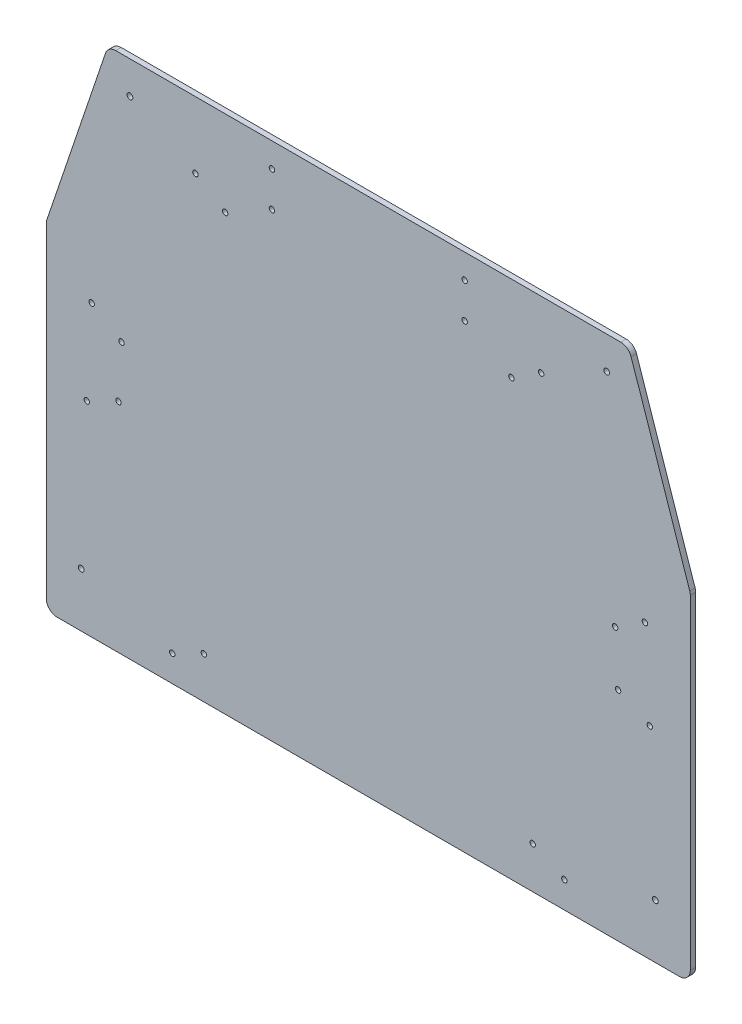
from build123d import *

# Parameters (mm, degrees)
SKETCH1_R                             = 5.3578125
BOSS_EXTRUDE1_DEPTH                   = 6.35
FILLET1_R                             = 6.35
CUT_EXTRUDE1_DEPTH                    = 1167.284548985
BOSS_EXTRUDE3_DEPTH                   = 6.35
SKETCH13_W                            = 3.175
SKETCH13_H                            = 76.2
F_1_4_0_25_DIAMETER_HOLE4_AT_2_COUNT  = 2
F_1_4_0_25_DIAMETER_HOLE4_AT_2_PITCH  = 459.678567638
F_1_4_0_25_DIAMETER_HOLE4_AT_3_COUNT  = 2
F_1_4_0_25_DIAMETER_HOLE4_AT_3_PITCH  = 596.539198556
F_1_4_0_25_DIAMETER_HOLE4_AT_4_COUNT  = 2
F_1_4_0_25_DIAMETER_HOLE4_AT_4_PITCH  = 568.707381741
F_1_4_0_25_DIAMETER_HOLE4_AT_5_COUNT  = 2
F_1_4_0_25_DIAMETER_HOLE4_AT_5_PITCH  = 422.93434027
F_1_4_0_25_DIAMETER_HOLE4_AT_6_COUNT  = 2
F_1_4_0_25_DIAMETER_HOLE4_AT_6_PITCH  = 592.904725038
F_1_4_0_25_DIAMETER_HOLE4_AT_7_COUNT  = 2
F_1_4_0_25_DIAMETER_HOLE4_AT_7_PITCH  = 634.11103449
F_1_4_0_25_DIAMETER_HOLE4_AT_8_COUNT  = 2
F_1_4_0_25_DIAMETER_HOLE4_AT_8_PITCH  = 622.278043561
F_1_4_0_25_DIAMETER_HOLE4_AT_9_COUNT  = 2
F_1_4_0_25_DIAMETER_HOLE4_AT_9_PITCH  = 661.65758107
F_1_4_0_25_DIAMETER_HOLE4_AT_10_COUNT = 2
F_1_4_0_25_DIAMETER_HOLE4_AT_10_PITCH = 648.217378276
F_1_4_0_25_DIAMETER_HOLE4_AT_11_COUNT = 2
F_1_4_0_25_DIAMETER_HOLE4_AT_11_PITCH = 613.575602616
F_1_4_0_25_DIAMETER_HOLE4_AT_12_COUNT = 2
F_1_4_0_25_DIAMETER_HOLE4_AT_12_PITCH = 522.113747952
F_1_4_0_25_DIAMETER_HOLE4_AT_13_COUNT = 2
F_1_4_0_25_DIAMETER_HOLE4_AT_13_PITCH = 562.417563003
F_1_4_0_25_DIAMETER_HOLE4_AT_14_COUNT = 2
F_1_4_0_25_DIAMETER_HOLE4_AT_14_PITCH = 501.478009771
F_1_4_0_25_DIAMETER_HOLE4_AT_15_COUNT = 2
F_1_4_0_25_DIAMETER_HOLE4_AT_15_PITCH = 482.69646419
F_1_4_0_25_DIAMETER_HOLE4_AT_16_COUNT = 2
F_1_4_0_25_DIAMETER_HOLE4_AT_16_PITCH = 322.499599747
F_1_4_0_25_DIAMETER_HOLE4_AT_17_COUNT = 2
F_1_4_0_25_DIAMETER_HOLE4_AT_17_PITCH = 292.440889916
F_1_4_0_25_DIAMETER_HOLE4_AT_18_COUNT = 2
F_1_4_0_25_DIAMETER_HOLE4_AT_18_PITCH = 41.275
F_1_4_0_25_DIAMETER_HOLE4_AT_19_COUNT = 2
F_1_4_0_25_DIAMETER_HOLE4_AT_19_PITCH = 232.85825455
F_1_4_0_25_DIAMETER_HOLE4_AT_20_COUNT = 2
F_1_4_0_25_DIAMETER_HOLE4_AT_20_PITCH = 229.170986574
SKETCH15_W                            = 754.968667661
SKETCH15_H                            = 28.575
CUT_EXTRUDE3_DEPTH                    = 1079.081505166
F_17_64_0_26563_DIAMETER_HOLE1_D      = 6.747002
CUT_EXTRUDE4_DEPTH                    = 1056.085396105
FILLET2_R                             = 12.7


with BuildPart() as part:
    # Sketch1 → Boss-Extrude1 (new body)
    with BuildSketch(Plane.XY):
        Polygon((128.546632935, 292.971606529), (382.546632935, 292.971606529), (776.246632935, -872.634633965), (-265.153367065, -872.634633965), align=None)
        with Locations((396.756156044, 191.371606529)):
            Circle(SKETCH1_R, mode=Mode.SUBTRACT)
        with Locations((114.659199441, 192.325199783)):
            Circle(SKETCH1_R, mode=Mode.SUBTRACT)
        with Locations((-193.570796303, -720.234633965)):
            Circle(SKETCH1_R, mode=Mode.SUBTRACT)
        with Locations((704.664062174, -720.234633965)):
            Circle(SKETCH1_R, mode=Mode.SUBTRACT)
        with Locations((491.127459301, -88.028393471)):
            Circle(SKETCH1_R, mode=Mode.SUBTRACT)
        with Locations((593.220051006, -390.288393471)):
            Circle(SKETCH1_R, mode=Mode.SUBTRACT)
        with Locations((19.96580657, -88.028393471)):
            Circle(SKETCH1_R, mode=Mode.SUBTRACT)
        with Locations((-82.126785136, -390.288393471)):
            Circle(SKETCH1_R, mode=Mode.SUBTRACT)
        with Locations((306.346632935, 271.727158802)):
            Circle(SKETCH1_R, mode=Mode.SUBTRACT)
        with Locations((204.746632935, 271.727158802)):
            Circle(SKETCH1_R, mode=Mode.SUBTRACT)
        with Locations((-82.126785136, -834.534633965)):
            Circle(SKETCH1_R, mode=Mode.SUBTRACT)
        with Locations((593.220051006, -834.534633965)):
            Circle(SKETCH1_R, mode=Mode.SUBTRACT)
        with BuildLine():
            Line((-180.239726648, -736.327985402), (-172.111642745, -712.26360816))
            ThreePointArc((-172.111642745, -712.26360816), (-156.015412172, -704.29546149), (-148.047265502, -720.391692063))
            Line((-148.047265502, -720.391692063), (-156.175349405, -744.456069305))
            ThreePointArc((-156.175349405, -744.456069305), (-172.271579978, -752.424215975), (-180.239726648, -736.327985402))
        make_face(mode=Mode.SUBTRACT)
        with BuildLine():
            Line((-94.231734473, -791.354633965), (-68.831734473, -791.354633965))
            ThreePointArc((-68.831734473, -791.354633965), (-56.131734473, -804.054633965), (-68.831734473, -816.754633965))
            Line((-68.831734473, -816.754633965), (-94.231734473, -816.754633965))
            ThreePointArc((-94.231734473, -816.754633965), (-106.931734473, -804.054633965), (-94.231734473, -791.354633965))
        make_face(mode=Mode.SUBTRACT)
        with BuildLine():
            Line((580.520051006, -791.354633965), (605.920051006, -791.354633965))
            ThreePointArc((605.920051006, -791.354633965), (618.620051006, -804.054633965), (605.920051006, -816.754633965))
            Line((605.920051006, -816.754633965), (580.520051006, -816.754633965))
            ThreePointArc((580.520051006, -816.754633965), (567.820051006, -804.054633965), (580.520051006, -791.354633965))
        make_face(mode=Mode.SUBTRACT)
        with BuildLine():
            Line((-68.772097635, -406.311820835), (-60.644013732, -382.247443592))
            ThreePointArc((-60.644013732, -382.247443592), (-44.54778316, -374.279296923), (-36.57963649, -390.375527495))
            Line((-36.57963649, -390.375527495), (-44.707720392, -414.439904738))
            ThreePointArc((-44.707720392, -414.439904738), (-60.803950965, -422.408051408), (-68.772097635, -406.311820835))
        make_face(mode=Mode.SUBTRACT)
        with BuildLine():
            Line((33.202373314, -104.401534553), (41.330457217, -80.33715731))
            ThreePointArc((41.330457217, -80.33715731), (57.426687789, -72.36901064), (65.394834459, -88.465241213))
            Line((65.394834459, -88.465241213), (57.266750557, -112.529618456))
            ThreePointArc((57.266750557, -112.529618456), (41.170519984, -120.497765125), (33.202373314, -104.401534553))
        make_face(mode=Mode.SUBTRACT)
        with BuildLine():
            Line((127.949253412, 176.110415433), (136.077337315, 200.174792676))
            ThreePointArc((136.077337315, 200.174792676), (152.173567887, 208.142939345), (160.141714557, 192.046708773))
            Line((160.141714557, 192.046708773), (152.013630654, 167.98233153))
            ThreePointArc((152.013630654, 167.98233153), (135.917400082, 160.01418486), (127.949253412, 176.110415433))
        make_face(mode=Mode.SUBTRACT)
        with BuildLine():
            Line((192.113515822, 253.947158802), (217.513515822, 253.947158802))
            ThreePointArc((217.513515822, 253.947158802), (230.213515822, 241.247158802), (217.513515822, 228.547158802))
            Line((217.513515822, 228.547158802), (192.113515822, 228.547158802))
            ThreePointArc((192.113515822, 228.547158802), (179.413515822, 241.247158802), (192.113515822, 253.947158802))
        make_face(mode=Mode.SUBTRACT)
        with BuildLine():
            Line((293.646632935, 253.947158802), (319.046632935, 253.947158802))
            ThreePointArc((319.046632935, 253.947158802), (331.746632935, 241.247158802), (319.046632935, 228.547158802))
            Line((319.046632935, 228.547158802), (293.646632935, 228.547158802))
            ThreePointArc((293.646632935, 228.547158802), (280.946632935, 241.247158802), (293.646632935, 253.947158802))
        make_face(mode=Mode.SUBTRACT)
        with BuildLine():
            Line((359.065010443, 168.025630302), (350.936926541, 192.090007545))
            ThreePointArc((350.936926541, 192.090007545), (358.905073211, 208.186238118), (375.001303783, 200.218091448))
            Line((375.001303783, 200.218091448), (383.129387686, 176.153714205))
            ThreePointArc((383.129387686, 176.153714205), (375.161241016, 160.057483633), (359.065010443, 168.025630302))
        make_face(mode=Mode.SUBTRACT)
        with BuildLine():
            Line((453.826515314, -112.529618456), (445.698431411, -88.465241213))
            ThreePointArc((445.698431411, -88.465241213), (453.666578081, -72.36901064), (469.762808654, -80.33715731))
            Line((469.762808654, -80.33715731), (477.890892557, -104.401534553))
            ThreePointArc((477.890892557, -104.401534553), (469.922745887, -120.497765125), (453.826515314, -112.529618456))
        make_face(mode=Mode.SUBTRACT)
        with BuildLine():
            Line((555.800986263, -414.439904738), (547.67290236, -390.375527495))
            ThreePointArc((547.67290236, -390.375527495), (555.64104903, -374.279296923), (571.737279603, -382.247443592))
            Line((571.737279603, -382.247443592), (579.865363506, -406.311820835))
            ThreePointArc((579.865363506, -406.311820835), (571.897216836, -422.408051408), (555.800986263, -414.439904738))
        make_face(mode=Mode.SUBTRACT)
        with BuildLine():
            Line((667.268615276, -744.456069305), (659.140531373, -720.391692063))
            ThreePointArc((659.140531373, -720.391692063), (667.108678043, -704.29546149), (683.204908616, -712.26360816))
            Line((683.204908616, -712.26360816), (691.332992518, -736.327985402))
            ThreePointArc((691.332992518, -736.327985402), (683.364845848, -752.424215975), (667.268615276, -744.456069305))
        make_face(mode=Mode.SUBTRACT)
    extrude(amount=BOSS_EXTRUDE1_DEPTH)

    # Fillet1
    fillet1_edges = [part.edges().sort_by_distance(p)[0] for p in [
        (128.546632935, 292.971606529, 3.175),
        (382.546632935, 292.971606529, 3.175),
        (776.246632935, -872.634633965, 3.175),
        (-265.153367065, -872.634633965, 3.175),
    ]]
    fillet(fillet1_edges, radius=FILLET1_R)

    # Sketch2 → Cut-Extrude1 (cut, through all)
    with BuildSketch(Plane.XY.offset(6.35)):
        with BuildLine():
            Line((91.647166248, -808.257330621), (67.972798838, -842.067831249))
            ThreePointArc((67.972798838, -842.067831249), (255.546632935, -247.159633965), (443.120467033, -842.067831249))
            Line((443.120467033, -842.067831249), (419.446099623, -808.257330621))
            ThreePointArc((419.446099623, -808.257330621), (255.546632935, -288.434633965), (91.647166248, -808.257330621))
        make_face()
    extrude(amount=-CUT_EXTRUDE1_DEPTH, mode=Mode.SUBTRACT)


with BuildPart() as body_2:
    # Sketch7 → Boss-Extrude3 (new body)
    with BuildSketch(Plane(origin=(0, 0, -63.5), x_dir=(-1, 0, 0), z_dir=(0, 0, -1))):
        Polygon((121.937700895, -872.634633965), (-633.030966766, -872.634633965), (-633.030966766, -448.623777416), (-547.825183006, -196.359633965), (36.731917136, -196.359633965), (121.937700895, -448.623777416), align=None)
    extrude(amount=BOSS_EXTRUDE3_DEPTH)

    # Sketch13 → 1/4 (0.25) Diameter Hole4 (revolve, cut)
    with BuildSketch(Plane(origin=(25.707349116, -813.178486157, -69.85), x_dir=(0, 1, 0), z_dir=(1, 0, 0))):
        with Locations((1.5875, 38.1)):
            Rectangle(SKETCH13_W, SKETCH13_H)
    f_1_4_0_25_diameter_hole4 = revolve(axis=Axis((25.707349116, -813.178486157, -76.2), (0, 0, 1)), mode=Mode.SUBTRACT)

    # 1/4 (0.25) Diameter Hole4 at 2: 1/4 (0.25) Diameter Hole4 ×2
    with Locations(*[(i * F_1_4_0_25_DIAMETER_HOLE4_AT_2_PITCH, 0, 0) for i in range(1, F_1_4_0_25_DIAMETER_HOLE4_AT_2_COUNT)]):
        add(f_1_4_0_25_diameter_hole4, mode=Mode.SUBTRACT)

    # 1/4 (0.25) Diameter Hole4 at 3: 1/4 (0.25) Diameter Hole4 ×2
    with Locations(*[Vector(0.9383907690341254, 0.345575989605098, 0) * (i * F_1_4_0_25_DIAMETER_HOLE4_AT_3_PITCH) for i in range(1, F_1_4_0_25_DIAMETER_HOLE4_AT_3_COUNT)]):
        add(f_1_4_0_25_diameter_hole4, mode=Mode.SUBTRACT)

    # 1/4 (0.25) Diameter Hole4 at 4: 1/4 (0.25) Diameter Hole4 ×2
    with Locations(*[Vector(0.9190282606116896, 0.39419164907066767, 0) * (i * F_1_4_0_25_DIAMETER_HOLE4_AT_4_PITCH) for i in range(1, F_1_4_0_25_DIAMETER_HOLE4_AT_4_COUNT)]):
        add(f_1_4_0_25_diameter_hole4, mode=Mode.SUBTRACT)

    # 1/4 (0.25) Diameter Hole4 at 5: 1/4 (0.25) Diameter Hole4 ×2
    with Locations(*[Vector(0.9990908894172673, 0.04263091229863252, 0) * (i * F_1_4_0_25_DIAMETER_HOLE4_AT_5_PITCH) for i in range(1, F_1_4_0_25_DIAMETER_HOLE4_AT_5_COUNT)]):
        add(f_1_4_0_25_diameter_hole4, mode=Mode.SUBTRACT)

    # 1/4 (0.25) Diameter Hole4 at 6: 1/4 (0.25) Diameter Hole4 ×2
    with Locations(*[Vector(0.8756676563773524, 0.4829142321102114, 0) * (i * F_1_4_0_25_DIAMETER_HOLE4_AT_6_PITCH) for i in range(1, F_1_4_0_25_DIAMETER_HOLE4_AT_6_COUNT)]):
        add(f_1_4_0_25_diameter_hole4, mode=Mode.SUBTRACT)

    # 1/4 (0.25) Diameter Hole4 at 7: 1/4 (0.25) Diameter Hole4 ×2
    with Locations(*[Vector(0.8737864077669905, 0.48630989461624, 0) * (i * F_1_4_0_25_DIAMETER_HOLE4_AT_7_PITCH) for i in range(1, F_1_4_0_25_DIAMETER_HOLE4_AT_7_COUNT)]):
        add(f_1_4_0_25_diameter_hole4, mode=Mode.SUBTRACT)

    # 1/4 (0.25) Diameter Hole4 at 8: 1/4 (0.25) Diameter Hole4 ×2
    with Locations(*[Vector(0.638946306539278, 0.7692513356243298, 0) * (i * F_1_4_0_25_DIAMETER_HOLE4_AT_8_PITCH) for i in range(1, F_1_4_0_25_DIAMETER_HOLE4_AT_8_COUNT)]):
        add(f_1_4_0_25_diameter_hole4, mode=Mode.SUBTRACT)

    # 1/4 (0.25) Diameter Hole4 at 9: 1/4 (0.25) Diameter Hole4 ×2
    with Locations(*[Vector(0.653649836215198, 0.7567971271191803, 0) * (i * F_1_4_0_25_DIAMETER_HOLE4_AT_9_PITCH) for i in range(1, F_1_4_0_25_DIAMETER_HOLE4_AT_9_COUNT)]):
        add(f_1_4_0_25_diameter_hole4, mode=Mode.SUBTRACT)

    # 1/4 (0.25) Diameter Hole4 at 10: 1/4 (0.25) Diameter Hole4 ×2
    with Locations(*[Vector(0.528870204123914, 0.8487027201499532, 0) * (i * F_1_4_0_25_DIAMETER_HOLE4_AT_10_PITCH) for i in range(1, F_1_4_0_25_DIAMETER_HOLE4_AT_10_COUNT)]):
        add(f_1_4_0_25_diameter_hole4, mode=Mode.SUBTRACT)

    # 1/4 (0.25) Diameter Hole4 at 11: 1/4 (0.25) Diameter Hole4 ×2
    with Locations(*[Vector(0.5587296100168245, 0.8293498796590297, 0) * (i * F_1_4_0_25_DIAMETER_HOLE4_AT_11_PITCH) for i in range(1, F_1_4_0_25_DIAMETER_HOLE4_AT_11_COUNT)]):
        add(f_1_4_0_25_diameter_hole4, mode=Mode.SUBTRACT)

    # 1/4 (0.25) Diameter Hole4 at 12: 1/4 (0.25) Diameter Hole4 ×2
    with Locations(*[Vector(0.22381274373799284, 0.9746321643268663, 0) * (i * F_1_4_0_25_DIAMETER_HOLE4_AT_12_PITCH) for i in range(1, F_1_4_0_25_DIAMETER_HOLE4_AT_12_COUNT)]):
        add(f_1_4_0_25_diameter_hole4, mode=Mode.SUBTRACT)

    # 1/4 (0.25) Diameter Hole4 at 13: 1/4 (0.25) Diameter Hole4 ×2
    with Locations(*[Vector(0.20777393552325948, 0.9781768713873665, 0) * (i * F_1_4_0_25_DIAMETER_HOLE4_AT_13_PITCH) for i in range(1, F_1_4_0_25_DIAMETER_HOLE4_AT_13_COUNT)]):
        add(f_1_4_0_25_diameter_hole4, mode=Mode.SUBTRACT)

    # 1/4 (0.25) Diameter Hole4 at 14: 1/4 (0.25) Diameter Hole4 ×2
    with Locations(*[Vector(0.05421214412483132, 0.9985294404419874, 0) * (i * F_1_4_0_25_DIAMETER_HOLE4_AT_14_PITCH) for i in range(1, F_1_4_0_25_DIAMETER_HOLE4_AT_14_COUNT)]):
        add(f_1_4_0_25_diameter_hole4, mode=Mode.SUBTRACT)

    # 1/4 (0.25) Diameter Hole4 at 15: 1/4 (0.25) Diameter Hole4 ×2
    with Locations(*[Vector(0.12860320029191077, 0.9916961313198105, 0) * (i * F_1_4_0_25_DIAMETER_HOLE4_AT_15_PITCH) for i in range(1, F_1_4_0_25_DIAMETER_HOLE4_AT_15_COUNT)]):
        add(f_1_4_0_25_diameter_hole4, mode=Mode.SUBTRACT)

    # 1/4 (0.25) Diameter Hole4 at 16: 1/4 (0.25) Diameter Hole4 ×2
    with Locations(*[Vector(-0.29271055030361265, 0.956201094823132, 0) * (i * F_1_4_0_25_DIAMETER_HOLE4_AT_16_PITCH) for i in range(1, F_1_4_0_25_DIAMETER_HOLE4_AT_16_COUNT)]):
        add(f_1_4_0_25_diameter_hole4, mode=Mode.SUBTRACT)

    # 1/4 (0.25) Diameter Hole4 at 17: 1/4 (0.25) Diameter Hole4 ×2
    with Locations(*[Vector(-0.20349043325815705, 0.9790769344502033, 0) * (i * F_1_4_0_25_DIAMETER_HOLE4_AT_17_PITCH) for i in range(1, F_1_4_0_25_DIAMETER_HOLE4_AT_17_COUNT)]):
        add(f_1_4_0_25_diameter_hole4, mode=Mode.SUBTRACT)

    # 1/4 (0.25) Diameter Hole4 at 18: 1/4 (0.25) Diameter Hole4 ×2
    with Locations(*[Vector(0.8995450382318291, 0.4368280258780305, 0) * (i * F_1_4_0_25_DIAMETER_HOLE4_AT_18_PITCH) for i in range(1, F_1_4_0_25_DIAMETER_HOLE4_AT_18_COUNT)]):
        add(f_1_4_0_25_diameter_hole4, mode=Mode.SUBTRACT)

    # 1/4 (0.25) Diameter Hole4 at 19: 1/4 (0.25) Diameter Hole4 ×2
    with Locations(*[Vector(-0.27046319797490564, 0.9627303145435835, 0) * (i * F_1_4_0_25_DIAMETER_HOLE4_AT_19_PITCH) for i in range(1, F_1_4_0_25_DIAMETER_HOLE4_AT_19_COUNT)]):
        add(f_1_4_0_25_diameter_hole4, mode=Mode.SUBTRACT)

    # 1/4 (0.25) Diameter Hole4 at 20: 1/4 (0.25) Diameter Hole4 ×2
    with Locations(*[Vector(-0.43682802587803055, 0.899545038231829, 0) * (i * F_1_4_0_25_DIAMETER_HOLE4_AT_20_PITCH) for i in range(1, F_1_4_0_25_DIAMETER_HOLE4_AT_20_COUNT)]):
        add(f_1_4_0_25_diameter_hole4, mode=Mode.SUBTRACT)

    # Sketch15 → Cut-Extrude3 (cut, through all)
    with BuildSketch(Plane.XY.offset(-63.5)):
        with Locations((255.546632935, -858.347133965)):
            Rectangle(SKETCH15_W, SKETCH15_H)
    extrude(amount=-CUT_EXTRUDE3_DEPTH, mode=Mode.SUBTRACT)

    # 17/64 (0.26563) Diameter Hole1 (through all)
    with Locations(Plane.XY.offset(-63.5)):
        with Locations((-23.853367065, -272.559633965), (534.946632935, -272.559633965), (592.096632935, -780.559633965), (-81.003367065, -780.559633965)):
            Hole(F_17_64_0_26563_DIAMETER_HOLE1_D / 2)

    # Sketch19 → Cut-Extrude4 (cut, through all)
    with BuildSketch(Plane.XY.offset(-63.5)):
        Polygon((547.825183006, -196.359633965), (560.693997087, -234.459633965), (-49.600731216, -234.459633965), (-36.731917136, -196.359633965), align=None)
    extrude(amount=-CUT_EXTRUDE4_DEPTH, mode=Mode.SUBTRACT)

    # Fillet2
    fillet2_edges = [body_2.edges().sort_by_distance(p)[0] for p in [
        (633.030966766, -448.623777416, -66.675),
        (-121.937700895, -448.623777416, -66.675),
        (-121.937700895, -844.059633965, -66.675),
        (633.030966766, -844.059633965, -66.675),
        (560.693997087, -234.459633965, -66.675),
        (-49.600731216, -234.459633965, -66.675),
    ]]
    fillet(fillet2_edges, radius=FILLET2_R)


solid = body_2.part
